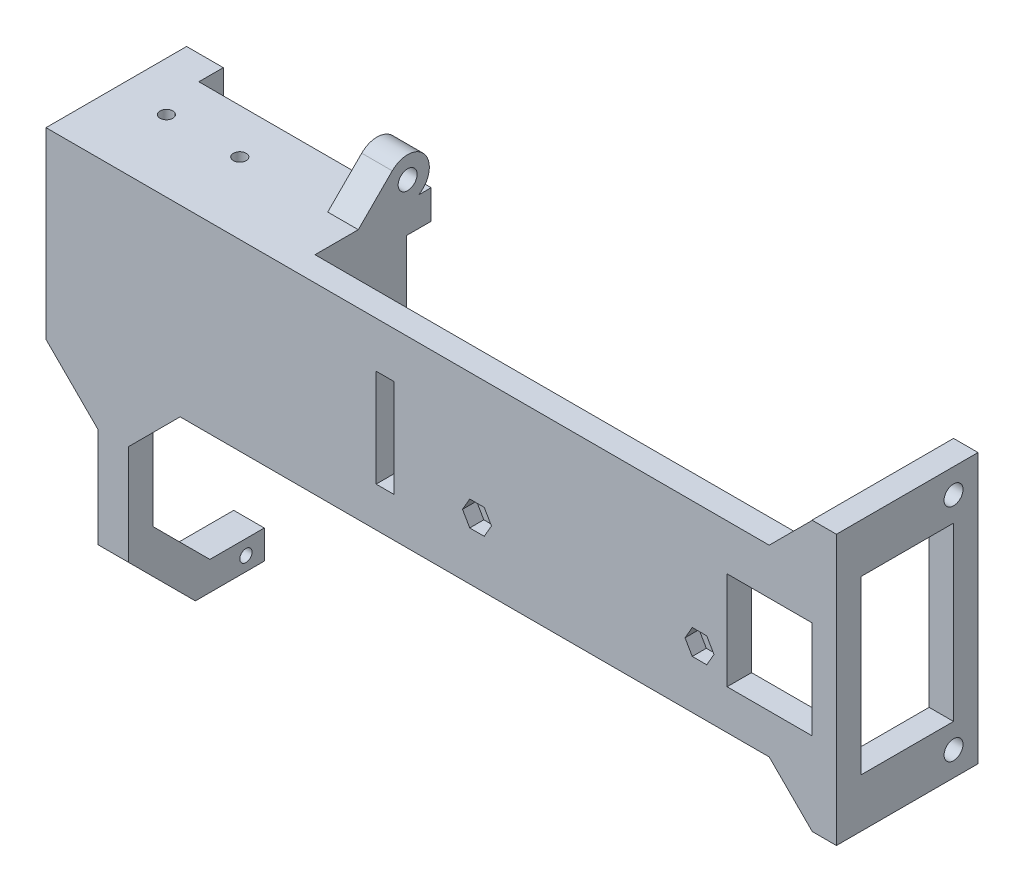
from build123d import *

# Parameters (mm, degrees)
SKETCH_1_W          = 40
SKETCH_1_H          = 30
EXTRUDE_1_DEPTH     = 15
SKETCH_3_R          = 1.55
EXTRUDE_2_DEPTH     = 5
SKETCH_4_W          = 6
SKETCH_4_H          = 4.77
EXTRUDE_3_DEPTH     = 4
SKETCH_5_W          = 129.3
SKETCH_5_H          = 30
SKETCH_5_W_2        = 13.8866
SKETCH_5_H_2        = 16
SKETCH_5_W_3        = 2.8866
EXTRUDE_4_DEPTH     = 4
SKETCH_7_R          = 1.55
SKETCH_7_W          = 4
SKETCH_7_H          = 0.95
SKETCH_7_H_2        = 28.1
EXTRUDE_5_DEPTH     = 4
SKETCH_8_R          = 1
EXTRUDE_6_DEPTH     = 5
EXTRUDE_7_DEPTH     = 5
EXTRUDE_8_DEPTH     = 4
SKETCH_12_R         = 1.05
CUT_EXTRUDE_1_DEPTH = 9
CUT_EXTRUDE_START   = -9
SKETCH_13_R         = 1.05
CUT_EXTRUDE_2_DEPTH = 9
CHAMFER_1_SIZE      = 7
CUT_EXTRUDE_3_REACH = 101.889
SKETCH_14_R         = 1
SKETCH_15_R         = 0.95
EXTRUDE_9_DEPTH     = 1
FILLET_1_R          = 0.5
CUT_EXTRUDE_4_DEPTH = 2.3


with BuildPart() as part:
    # 草图1 → 凸台-拉伸1 (new body)
    with BuildSketch(Plane.XY):
        with Locations((-64.15, 0.5)):
            Rectangle(SKETCH_1_W, SKETCH_1_H)
    extrude(amount=-EXTRUDE_1_DEPTH)

    # 草图3 → 凸台-拉伸2 (add)
    with BuildSketch(Plane(origin=(-44.15, 0, 0), x_dir=(0, 0, -1), z_dir=(1, 0, 0))):
        with BuildLine():
            Line((7.084541854, 15.5), (15, 15.5))
            Line((15, 15.5), (15, 15.003385417))
            ThreePointArc((15, 15.003385417), (18.463655357, 19.83658452), (12.644770927, 21.060229073))
            Line((12.644770927, 21.060229073), (7.084541854, 15.5))
        make_face()
        with Locations((15.155, 18.55)):
            Circle(SKETCH_3_R, mode=Mode.SUBTRACT)
    extrude_2 = extrude(amount=-EXTRUDE_2_DEPTH)

    # 镜向2: 凸台-拉伸2 across plane
    add(extrude_2.mirror(Plane.ZX.offset(0.5)))

    # 草图4 → 凸台-拉伸3 (add)
    with BuildSketch(Plane(origin=(0, 0, -15), x_dir=(-1, 0, 0), z_dir=(0, 0, -1))):
        with Locations((47.15, 13.115)):
            Rectangle(SKETCH_4_W, SKETCH_4_H)
        with Locations((81.15, 13.115)):
            Rectangle(SKETCH_4_W, SKETCH_4_H)
        with Locations((81.15, -12.115)):
            Rectangle(SKETCH_4_W, SKETCH_4_H)
        with Locations((47.15, -12.115)):
            Rectangle(SKETCH_4_W, SKETCH_4_H)
    extrude(amount=EXTRUDE_3_DEPTH)

    # 草图5 → 凸台-拉伸4 (add)
    with BuildSketch(Plane.XY):
        with Locations((-19.5, 0.5)):
            Rectangle(SKETCH_5_W, SKETCH_5_H)
        with Locations((34.2067, 0)):
            Rectangle(SKETCH_5_W_2, SKETCH_5_H_2, mode=Mode.SUBTRACT)
        with Locations((-28.7067, 0)):
            Rectangle(SKETCH_5_W_3, SKETCH_5_H_2, mode=Mode.SUBTRACT)
    extrude(amount=EXTRUDE_4_DEPTH)

    # 草图7 → 凸台-拉伸5 (add)
    # profile 1 of 4: a face of its own
    with BuildSketch(Plane(origin=(45.15, 0, 0), x_dir=(0, 0, -1), z_dir=(1, 0, 0))):
        Polygon((19.155, -21.55), (19.155, -13.55), (15.155, -13.55), (0, -13.55), (0, -14.5), (-4, -14.5), (-4, -21.55), align=None)
        with Locations((15.155, -17.55)):
            Circle(SKETCH_7_R, mode=Mode.SUBTRACT)
    # profile 2 of 4: a face of its own
    with BuildSketch(Plane(origin=(45.15, 0, 0), x_dir=(0, 0, -1), z_dir=(1, 0, 0))):
        with Locations((-2, -14.025)):
            Rectangle(SKETCH_7_W, SKETCH_7_H)
    # profile 3 of 4: a face of its own
    with BuildSketch(Plane(origin=(45.15, 0, 0), x_dir=(0, 0, -1), z_dir=(1, 0, 0))):
        with Locations((17.155, 0.5)):
            Rectangle(SKETCH_7_W, SKETCH_7_H_2)
    # profile 4 of 4: a face of its own
    with BuildSketch(Plane(origin=(45.15, 0, 0), x_dir=(0, 0, -1), z_dir=(1, 0, 0))):
        Polygon((19.155, 14.55), (19.155, 22.55), (-4, 22.55), (-4, 15.5), (0, 15.5), (0, 14.55), (15.155, 14.55), align=None)
        with Locations((15.155, 18.55)):
            Circle(SKETCH_7_R, mode=Mode.SUBTRACT)
    extrude(amount=-EXTRUDE_5_DEPTH)

    # 草图8 → 凸台-拉伸6 (add)
    with BuildSketch(Plane(origin=(-75.679663749, 0, 0), x_dir=(0, 0, -1), z_dir=(1, 0, 0))):
        Polygon((13.392359313, -23.095757056), (18.235, -23.095757056), (18.235, -19.453116369), (13.281883631, -14.5), (4.796602257, -14.5), align=None)
        with Locations((15.235, -20.695757056)):
            Circle(SKETCH_8_R, mode=Mode.SUBTRACT)
    extrude(amount=EXTRUDE_6_DEPTH)



with BuildPart() as body_2:
    # 草图9 → 凸台-拉伸7 (new body)
    with BuildSketch(Plane(origin=(-75.679663749, 0, 0), x_dir=(0, 0, -1), z_dir=(1, 0, 0))):
        Polygon((-4, -39.331824868), (-4, -32.260757056), (9.335, -45.595757056), (9.335, -50.295757056), (6.963932188, -50.295757056), align=None)
        with BuildLine():
            Line((9.335, -45.595757056), (9.335, -50.295757056))
            Line((9.335, -50.295757056), (14.585, -50.295757056))
            Line((14.585, -50.295757056), (14.585, -48.755691264))
            ThreePointArc((14.585, -48.755691264), (14.816669987, -47.08746195), (16.235, -47.995757056))
            ThreePointArc((16.235, -47.995757056), (16.143295106, -48.41408707), (15.885, -48.755691264))
            Line((15.885, -48.755691264), (15.885, -50.295757056))
            Line((15.885, -50.295757056), (18.235, -50.295757056))
            Line((18.235, -50.295757056), (18.235, -45.595757056))
            Line((18.235, -45.595757056), (9.335, -45.595757056))
        make_face()
        with BuildLine():
            Line((14.585, -48.755691264), (14.585, -50.295757056))
            Line((14.585, -50.295757056), (15.885, -50.295757056))
            Line((15.885, -50.295757056), (15.885, -48.755691264))
            ThreePointArc((15.885, -48.755691264), (15.235, -48.995757056), (14.585, -48.755691264))
        make_face()
    extrude(amount=EXTRUDE_7_DEPTH)


with BuildPart() as part_1:
    add(part.part)

    add(body_2.part)  # 凸台-拉伸8 merges body 2
    # 草图11 → 凸台-拉伸8 (add)
    with BuildSketch(Plane.XY.offset(4)):
        Polygon((-70.679663749, -39.331824868), (-70.679663749, -22.970336251), (-62.209327497, -14.5), (-84.15, -14.5), (-75.679663749, -22.970336251), (-75.679663749, -39.331824868), align=None)
    extrude(amount=-EXTRUDE_8_DEPTH)

    # 草图12 → 切除-拉伸1 (cut)
    with BuildSketch(Plane(origin=(0, 15.5, 0), x_dir=(1, 0, 0), z_dir=(0, 1, 0))):
        with Locations(Location((-76.15, 7.7, 0), (0, 0, 180))):
            Circle(SKETCH_12_R)
        with Locations(Location((-64.15, 7.7, 0), (0, 0, 180))):
            Circle(SKETCH_12_R)
    extrude(amount=-CUT_EXTRUDE_1_DEPTH, mode=Mode.SUBTRACT)

    # 草图13 → 切除-拉伸2 (cut)
    with BuildSketch(Plane.XZ.offset(14.5).offset(CUT_EXTRUDE_START)):
        with Locations(Location((-64.15, -7.7, 0), (0, 0, 180))):
            Circle(SKETCH_13_R)
        with Locations((-79.652663002, -7.7)):
            Circle(SKETCH_13_R)
    extrude(amount=CUT_EXTRUDE_2_DEPTH, mode=Mode.SUBTRACT)

    # 倒角1
    chamfer_1_edges = [part_1.edges().sort_by_distance(p)[0] for p in [
        (41.15, -14.5, 2),
        (41.15, 15.5, 2),
    ]]
    chamfer(chamfer_1_edges, length=CHAMFER_1_SIZE)

    # 草图14 → 切除-拉伸3 (cut, up to next)
    with BuildSketch(Plane(origin=(0, 0, 0), x_dir=(-1, 0, 0), z_dir=(0, 0, -1)), mode=Mode.PRIVATE) as cut_extrude_3_sk1:
        with Locations((-22.75, -4.5)):
            Circle(SKETCH_14_R)
    cut_extrude_3_tool1 = extrude(cut_extrude_3_sk1.sketch, amount=-CUT_EXTRUDE_3_REACH, mode=Mode.PRIVATE) & part_1.part
    # 草图14 → 切除-拉伸3 (cut, up to next)
    with BuildSketch(Plane(origin=(0, 0, 0), x_dir=(-1, 0, 0), z_dir=(0, 0, -1)), mode=Mode.PRIVATE) as cut_extrude_3_sk2:
        with Locations((13.65, -4.5)):
            Circle(SKETCH_14_R)
    cut_extrude_3_tool2 = extrude(cut_extrude_3_sk2.sketch, amount=-CUT_EXTRUDE_3_REACH, mode=Mode.PRIVATE) & part_1.part
    add(cut_extrude_3_tool1.solids().sort_by_distance((22.75, -4.5, 0))[0], mode=Mode.SUBTRACT)
    add(cut_extrude_3_tool2.solids().sort_by_distance((-13.65, -4.5, 0))[0], mode=Mode.SUBTRACT)

    # 草图15 → 凸台-拉伸9 (add)
    with BuildSketch(Plane(origin=(0, 0, 0), x_dir=(-1, 0, 0), z_dir=(0, 0, -1))):
        with Locations((18.27, -4.5)):
            Circle(SKETCH_15_R)
        with Locations((-18.1, -4.5)):
            Circle(SKETCH_15_R)
    extrude(amount=EXTRUDE_9_DEPTH)

    # 圆角1
    fillet_1_edges = [part_1.edges().sort_by_distance(p)[0] for p in [
        (-17.32, -4.5, -1),
        (19.05, -4.5, -1),
    ]]
    fillet(fillet_1_edges, radius=FILLET_1_R)

    # 草图16 → 切除-拉伸4 (cut)
    with BuildSketch(Plane.XY.offset(4)):
        Polygon((25.117136104, -4.5), (23.933568052, -2.45), (21.566431948, -2.45), (20.382863896, -4.5), (21.566431948, -6.55), (23.933568052, -6.55), align=None)
        Polygon((-11.282863896, -4.5), (-12.466431948, -2.45), (-14.833568052, -2.45), (-16.017136104, -4.5), (-14.833568052, -6.55), (-12.466431948, -6.55), align=None)
    extrude(amount=-CUT_EXTRUDE_4_DEPTH, mode=Mode.SUBTRACT)


solid = part_1.part
